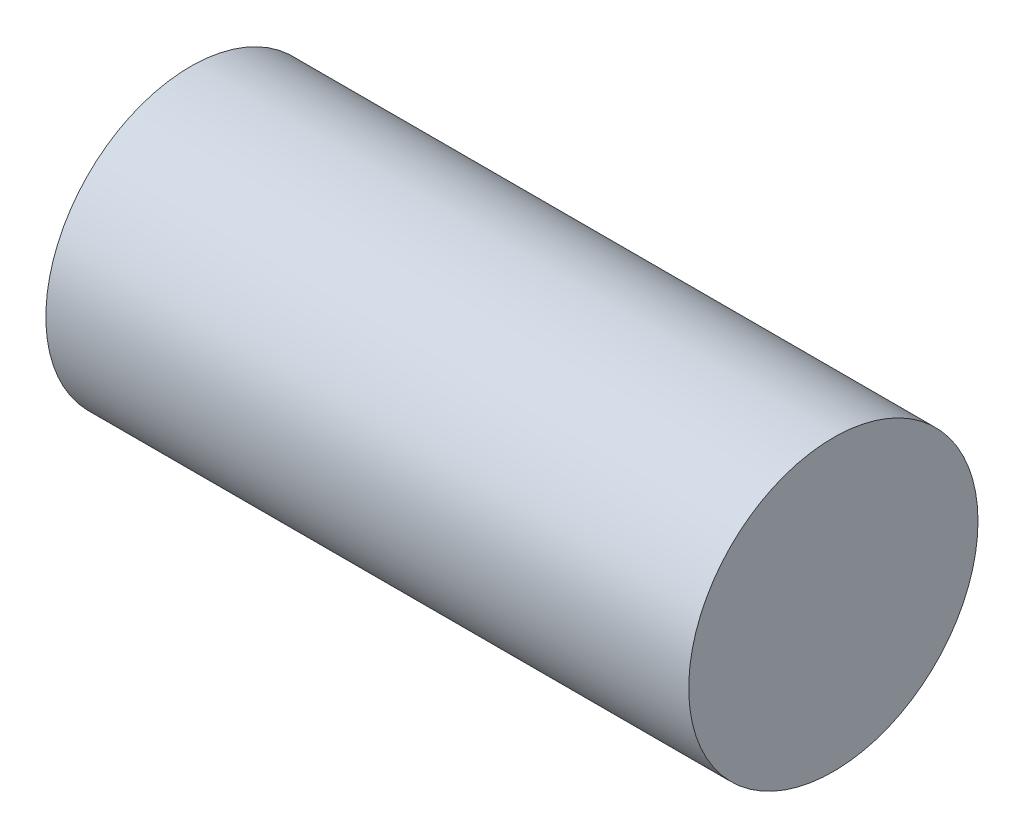
from build123d import *

# Parameters (mm, degrees)
SKETCH_1_R      = 4.5
EXTRUDE_1_DEPTH = 20


with BuildPart() as part:
    # 草图1 → 凸台-拉伸1 (new body)
    with BuildSketch(Plane(origin=(0, 0, 0), x_dir=(0, 0, -1), z_dir=(1, 0, 0))):
        with Locations((-10.639921851, -4.70611928)):
            Circle(SKETCH_1_R)
    extrude(amount=EXTRUDE_1_DEPTH)


solid = part.part
